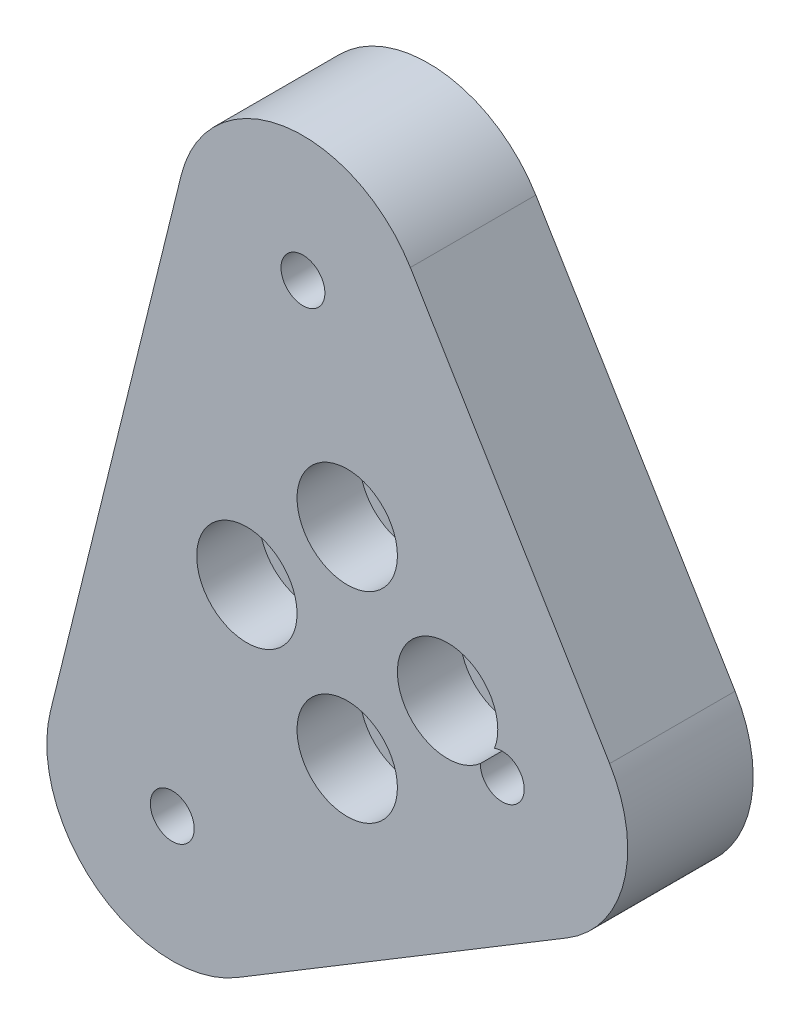
from build123d import *

# Parameters (mm, degrees)
SKETCH1_R               = 9
BOSS_EXTRUDE1_DEPTH     = 70
SKETCH2_R               = 2.5
CUT_EXTRUDE1_DEPTH      = 5
CUT_EXTRUDE2_REACH      = 90.987
CUT_EXTRUDE2_END_RADIUS = 9
SKETCH3_R               = 1.75
CIRPATTERN1_COUNT       = 3
SKETCH5_W               = 24.568161226
SKETCH5_H               = 25
SKETCH6_R               = 9
BOSS_EXTRUDE2_DEPTH     = 5
SKETCH8_R               = 9
SKETCH8_R_2             = 5.0505014
BOSS_EXTRUDE3_DEPTH     = 3
CUT_EXTRUDE3_REACH      = 83.112
SKETCH9_R               = 1.875
SKETCH11_R              = 4
CUT_EXTRUDE4_DEPTH      = 3
CUT_EXTRUDE5_DEPTH      = 82.111701173
CUT_EXTRUDE5_DEPTH_BACK = 82.111701173
SKETCH12_W              = 69.923732777
SKETCH12_H              = 71.865657343
SKETCH13_R              = 4
BOSS_EXTRUDE5_DEPTH     = 5
SKETCH14_R              = 1.75
CUT_EXTRUDE6_DEPTH      = 43.17947431


with BuildPart() as part:
    # Sketch1 → Boss-Extrude1 (new body)
    with BuildSketch(Plane.XY):
        with BuildLine():
            Line((-23.6546385, -16.539669722), (-13.23734813, 25.649078182))
            ThreePointArc((-13.23734813, 25.649078182), (-5.029445343, 33.138647287), (5.031042671, 28.421667909))
            Line((5.031042671, 28.421667909), (20.916771438, 2.118648772))
            ThreePointArc((20.916771438, 2.118648772), (22.065215706, -5.448366461), (17.526600651, -11.611126974))
            Line((17.526600651, -11.611126974), (-8.776418486, -27.496855741))
            ThreePointArc((-8.776418486, -27.496855741), (-19.876207308, -26.988917124), (-23.6546385, -16.539669722))
        make_face()
        Circle(SKETCH1_R, mode=Mode.SUBTRACT)
    extrude(amount=BOSS_EXTRUDE1_DEPTH)

    # Sketch2 → Cut-Extrude1 (cut)
    with BuildSketch(Plane(origin=(9.822624711, -16.263949206, 0), x_dir=(0.8559973266359324, 0.5169802479709809, 0), z_dir=(0.5169802479709809, -0.8559973266359324, 0))):
        with Locations((0, 65)):
            Circle(SKETCH2_R)
    cut_extrude1 = extrude(amount=-CUT_EXTRUDE1_DEPTH, mode=Mode.SUBTRACT)

    # Cut-Extrude2: up to this cylinder (the profile starts outside it)
    cut_extrude2_end = Plane(origin=(0, 0, 65), z_dir=(0, 0, -1)) * Cylinder(CUT_EXTRUDE2_END_RADIUS, 200.974, mode=Mode.PRIVATE)
    # Sketch3 → Cut-Extrude2 (cut, up to the surface)
    with BuildSketch(Plane(origin=(7.237723472, -11.983962573, 0), x_dir=(0.8559973266359324, 0.5169802479709809, 0), z_dir=(0.5169802479709809, -0.8559973266359324, 0)), mode=Mode.PRIVATE) as cut_extrude2_sk1:
        with Locations((0, 65)):
            Circle(SKETCH3_R)
    cut_extrude2_tool1 = extrude(cut_extrude2_sk1.sketch, amount=-CUT_EXTRUDE2_REACH, mode=Mode.PRIVATE) - cut_extrude2_end
    cut_extrude2 = cut_extrude2_tool1.solids().sort_by_distance((7.237723, -11.983963, 65))[0]
    add(cut_extrude2, mode=Mode.SUBTRACT)

    # CirPattern1: Cut-Extrude1, Cut-Extrude2 ×3 about axis
    cirpattern1_axis = Axis((0, 0, 0), (0, 0, 1))
    add([cut_extrude1.rotate(cirpattern1_axis, i * 360 / CIRPATTERN1_COUNT) for i in range(1, CIRPATTERN1_COUNT)], mode=Mode.SUBTRACT)
    add([cut_extrude2.rotate(cirpattern1_axis, i * 360 / CIRPATTERN1_COUNT) for i in range(1, CIRPATTERN1_COUNT)], mode=Mode.SUBTRACT)

    # Sketch5 → Cut-Revolve1 (revolve, cut)
    with BuildSketch(Plane(origin=(0, 0, 0), x_dir=(1, 0, 0), z_dir=(0, 1, 0)), mode=Mode.PRIVATE) as cut_revolve1_sk:
        with Locations((-12.284080613, -17.5)):
            Rectangle(SKETCH5_W, SKETCH5_H)
    revolve(cut_revolve1_sk.sketch.rotate(Axis((0, 0, 0), (0, 0, 1)), 180), axis=Axis((0, 0, 0), (0, 0, 1)), mode=Mode.SUBTRACT)

    # Sketch6 → Boss-Extrude2 (add)
    with BuildSketch(Plane(origin=(0, 0, 0), x_dir=(-1, 0, 0), z_dir=(0, 0, -1))):
        with Locations(Location((0, 0, 0), (0, 0, 180))):
            Circle(SKETCH6_R)
    extrude(amount=-BOSS_EXTRUDE2_DEPTH)

    # Sketch8 → Boss-Extrude3 (add)
    with BuildSketch(Plane(origin=(0, 0, 30), x_dir=(-1, 0, 0), z_dir=(0, 0, -1))):
        Circle(SKETCH8_R)
        Circle(SKETCH8_R_2, mode=Mode.SUBTRACT)
    extrude(amount=-BOSS_EXTRUDE3_DEPTH)

    # Sketch9 → Cut-Extrude3 (cut, up to next)
    with BuildSketch(Plane(origin=(0, 0, 0), x_dir=(-1, 0, 0), z_dir=(0, 0, -1)), mode=Mode.PRIVATE) as cut_extrude3_sk1:
        with Locations((0, 8)):
            Circle(SKETCH9_R)
    cut_extrude3_tool1 = extrude(cut_extrude3_sk1.sketch, amount=-CUT_EXTRUDE3_REACH, mode=Mode.PRIVATE) & part.part
    # Sketch9 → Cut-Extrude3 (cut, up to next)
    with BuildSketch(Plane(origin=(0, 0, 0), x_dir=(-1, 0, 0), z_dir=(0, 0, -1)), mode=Mode.PRIVATE) as cut_extrude3_sk2:
        with Locations((8, 0)):
            Circle(SKETCH9_R)
    cut_extrude3_tool2 = extrude(cut_extrude3_sk2.sketch, amount=-CUT_EXTRUDE3_REACH, mode=Mode.PRIVATE) & part.part
    # Sketch9 → Cut-Extrude3 (cut, up to next)
    with BuildSketch(Plane(origin=(0, 0, 0), x_dir=(-1, 0, 0), z_dir=(0, 0, -1)), mode=Mode.PRIVATE) as cut_extrude3_sk3:
        with Locations((0, -8)):
            Circle(SKETCH9_R)
    cut_extrude3_tool3 = extrude(cut_extrude3_sk3.sketch, amount=-CUT_EXTRUDE3_REACH, mode=Mode.PRIVATE) & part.part
    # Sketch9 → Cut-Extrude3 (cut, up to next)
    with BuildSketch(Plane(origin=(0, 0, 0), x_dir=(-1, 0, 0), z_dir=(0, 0, -1)), mode=Mode.PRIVATE) as cut_extrude3_sk4:
        with Locations((-8, 0)):
            Circle(SKETCH9_R)
    cut_extrude3_tool4 = extrude(cut_extrude3_sk4.sketch, amount=-CUT_EXTRUDE3_REACH, mode=Mode.PRIVATE) & part.part
    add(cut_extrude3_tool1.solids().sort_by_distance((0, 8, 0))[0], mode=Mode.SUBTRACT)
    add(cut_extrude3_tool2.solids().sort_by_distance((-8, 0, 0))[0], mode=Mode.SUBTRACT)
    add(cut_extrude3_tool3.solids().sort_by_distance((0, -8, 0))[0], mode=Mode.SUBTRACT)
    add(cut_extrude3_tool4.solids().sort_by_distance((8, 0, 0))[0], mode=Mode.SUBTRACT)

    # Sketch11 → Cut-Extrude4 (cut)
    with BuildSketch(Plane(origin=(0, 0, 0), x_dir=(-1, 0, 0), z_dir=(0, 0, -1))):
        Circle(SKETCH11_R)
    extrude(amount=-CUT_EXTRUDE4_DEPTH, mode=Mode.SUBTRACT)

    # Sketch12 → Cut-Extrude5 (cut, two sides: drawn at the far end of the back side and taken through both)
    with BuildSketch(Plane(origin=(0, 0, 0), x_dir=(0, 0, -1), z_dir=(1, 0, 0)).offset(-CUT_EXTRUDE5_DEPTH_BACK)):
        with Locations((-39.961866388, -0.358209869)):
            Rectangle(SKETCH12_W, SKETCH12_H)
    extrude(amount=CUT_EXTRUDE5_DEPTH + CUT_EXTRUDE5_DEPTH_BACK, mode=Mode.SUBTRACT)

    # Sketch13 → Boss-Extrude5 (add)
    with BuildSketch(Plane.XY.offset(5)):
        with BuildLine():
            Line((-8.776418486, -27.496855741), (17.526600651, -11.611126974))
            ThreePointArc((17.526600651, -11.611126974), (22.065215706, -5.448366461), (20.916771438, 2.118648772))
            Line((20.916771438, 2.118648772), (5.031042671, 28.421667909))
            ThreePointArc((5.031042671, 28.421667909), (-5.029445343, 33.138647287), (-13.23734813, 25.649078182))
            Line((-13.23734813, 25.649078182), (-23.6546385, -16.539669722))
            ThreePointArc((-23.6546385, -16.539669722), (-19.876207308, -26.988917124), (-8.776418486, -27.496855741))
        make_face()
        with Locations((-8, 0)):
            Circle(SKETCH13_R, mode=Mode.SUBTRACT)
        with Locations((0, 8)):
            Circle(SKETCH13_R, mode=Mode.SUBTRACT)
        with Locations((8, 0)):
            Circle(SKETCH13_R, mode=Mode.SUBTRACT)
        with Locations((0, -8)):
            Circle(SKETCH13_R, mode=Mode.SUBTRACT)
    extrude(amount=BOSS_EXTRUDE5_DEPTH)

    # Sketch14 → Cut-Extrude6 (cut, through all)
    with BuildSketch(Plane(origin=(0, 0, 0), x_dir=(-1, 0, 0), z_dir=(0, 0, -1))):
        with Locations((3.528930595, 23.25186543)):
            Circle(SKETCH14_R)
        with Locations((-12.356798171, -3.051153708)):
            Circle(SKETCH14_R)
        with Locations((13.946220966, -18.936882475)):
            Circle(SKETCH14_R)
    extrude(amount=-CUT_EXTRUDE6_DEPTH, mode=Mode.SUBTRACT)


solid = part.part
